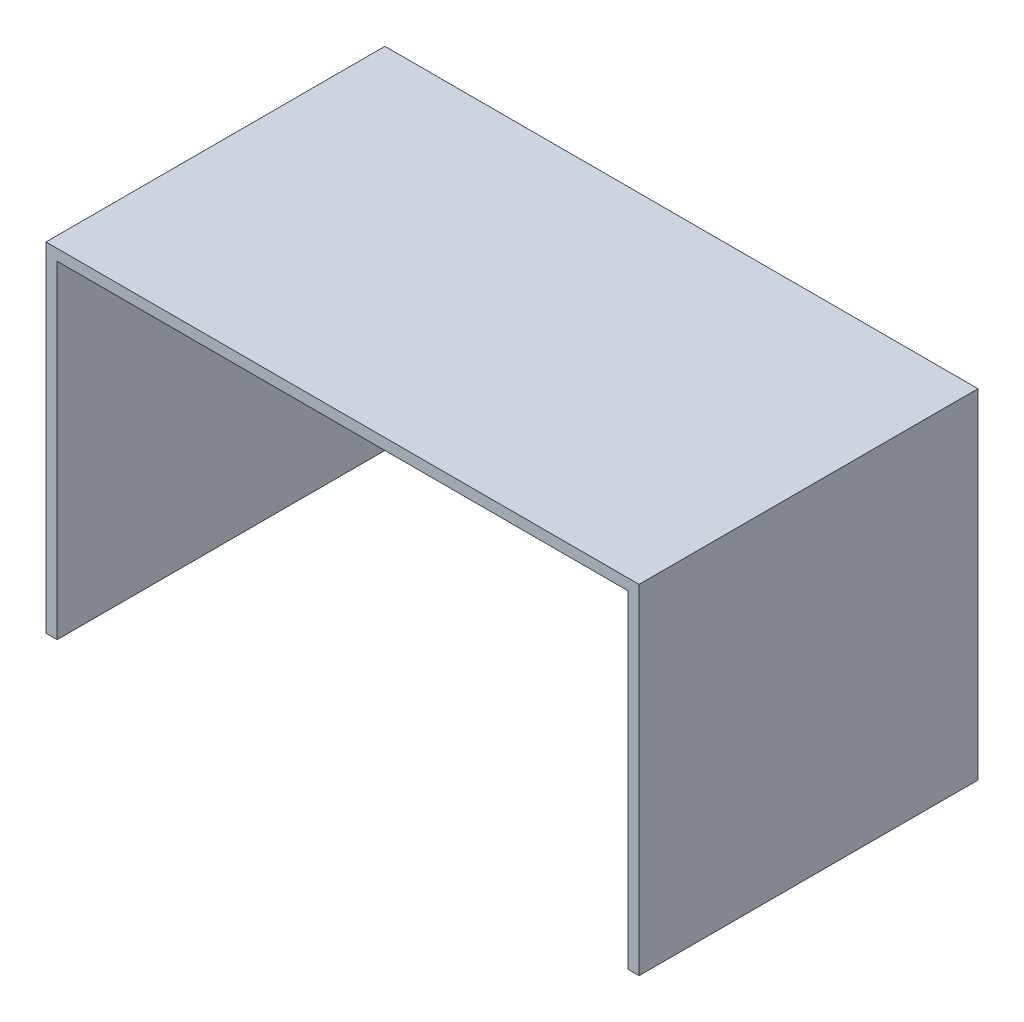
from build123d import *

# Parameters (mm, degrees)
SKETCH1_W           = 0.5334
SKETCH1_H           = 0.3048
BOSS_EXTRUDE1_DEPTH = 0.1524
SKETCH2_W           = 0.5134
SKETCH2_H           = 0.2948
CUT_EXTRUDE1_DEPTH  = 0.2948


with BuildPart() as part:
    # Sketch1 → Boss-Extrude1 (new, symmetric)
    with BuildSketch(Plane.XY):
        Rectangle(SKETCH1_W, SKETCH1_H)
    extrude(amount=BOSS_EXTRUDE1_DEPTH, both=True)

    # Sketch2 → Cut-Extrude1 (cut)
    with BuildSketch(Plane.XY.offset(0.1524)):
        with Locations((0, -0.005)):
            Rectangle(SKETCH2_W, SKETCH2_H)
    extrude(amount=-CUT_EXTRUDE1_DEPTH, mode=Mode.SUBTRACT)


solid = part.part
